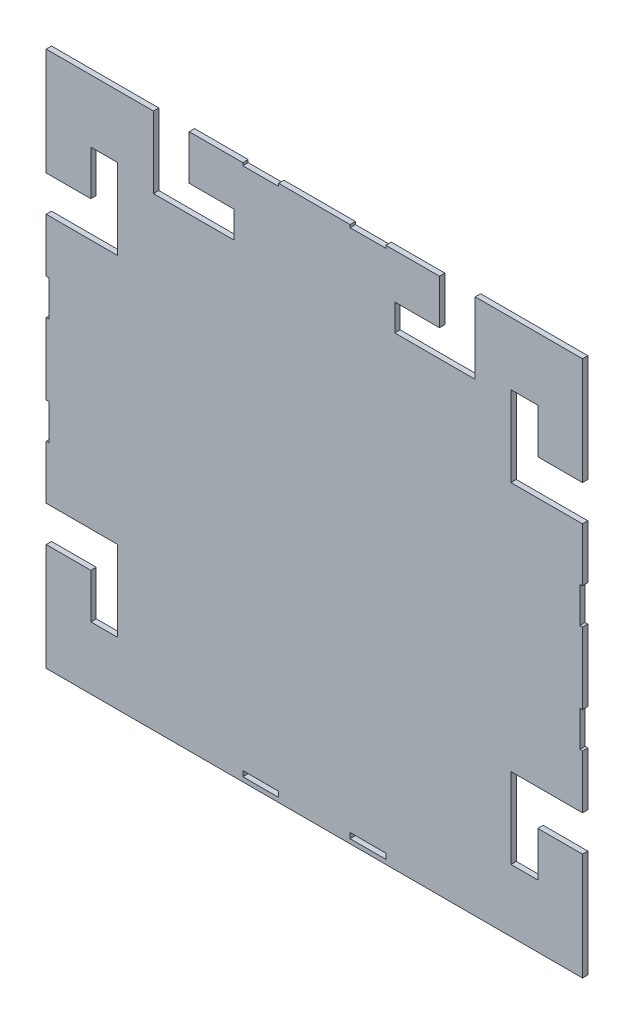
from build123d import *

# Parameters (mm, degrees)
ESBO_O2_W                = 20
ESBO_O2_H                = 3
RESSALTO_EXTRUS_O1_DEPTH = 3


with BuildPart() as part:
    # Esboço2 → Ressalto-extrusão1 (new body)
    with BuildSketch(Plane.XY):
        Polygon((-63.645119203, -170), (-63.645119203, -110), (-38.645119203, -110), (-38.645119203, -135), (-23.645119203, -135), (-23.645119203, -90), (-63.645119203, -90), (-63.645119203, -60), (-62.145119203, -60), (-62.145119203, -40), (-63.645119203, -40), (-63.645119203, 0), (-62.145119203, 0), (-62.145119203, 20), (-63.645119203, 20), (-63.645119203, 50), (-23.645119203, 50), (-23.645119203, 95), (-38.645119203, 95), (-38.645119203, 70), (-63.645119203, 70), (-63.645119203, 130), (-3.645119203, 130), (-3.645119203, 90), (41.354880797, 90), (41.354880797, 105), (16.354880797, 105), (16.354880797, 130), (46.354880797, 130), (46.354880797, 128.5), (66.354880797, 128.5), (66.354880797, 130), (106.354880797, 130), (106.354880797, 128.5), (126.354880797, 128.5), (126.354880797, 130), (156.354880797, 130), (156.354880797, 105), (131.354880797, 105), (131.354880797, 90), (176.354880797, 90), (176.354880797, 130), (236.354880797, 130), (236.354880797, 70), (211.354880797, 70), (211.354880797, 95), (196.354880797, 95), (196.354880797, 50), (236.354880797, 50), (236.354880797, 20), (234.854880797, 20), (234.854880797, 0), (236.354880797, 0), (236.354880797, -40), (234.854880797, -40), (234.854880797, -60), (236.354880797, -60), (236.354880797, -90), (196.354880797, -90), (196.354880797, -135), (211.354880797, -135), (211.354880797, -110), (236.354880797, -110), (236.354880797, -170), align=None)
        with Locations((56.354880797, -166)):
            Rectangle(ESBO_O2_W, ESBO_O2_H, mode=Mode.SUBTRACT)
        with Locations((116.354880797, -166)):
            Rectangle(ESBO_O2_W, ESBO_O2_H, mode=Mode.SUBTRACT)
    extrude(amount=RESSALTO_EXTRUS_O1_DEPTH)


solid = part.part
